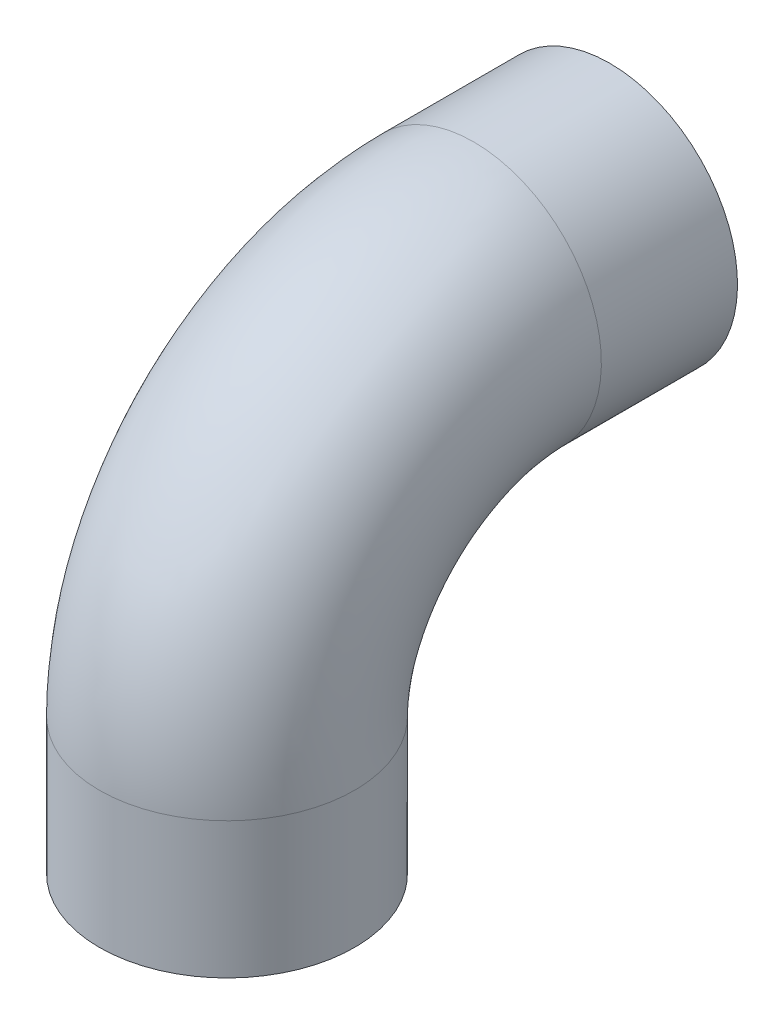
from build123d import *

# Parameters (mm, degrees)
SKETCH1_R   = 14.2875
SKETCH1_R_2 = 10.668


with BuildPart() as part:
    # Sweep1: sweep along a path in Sketch2
    with BuildLine(Plane(origin=(0, 0, 0), x_dir=(0, 0, -1), z_dir=(1, 0, 0))) as sweep1_path:
        Line((0, 0), (0, 15.24))
        ThreePointArc((0, 15.24), (8.090442937, 34.772057063), (27.6225, 42.8625))
        Line((27.6225, 42.8625), (42.8625, 42.8625))
    # Sketch1 → Sweep1 (sweep)
    with BuildSketch(Plane(origin=(0, 0, 0), x_dir=(1, 0, 0), z_dir=(0, 1, 0))):
        Circle(SKETCH1_R)
        Circle(SKETCH1_R_2, mode=Mode.SUBTRACT)
    sweep(path=sweep1_path.line)


solid = part.part
